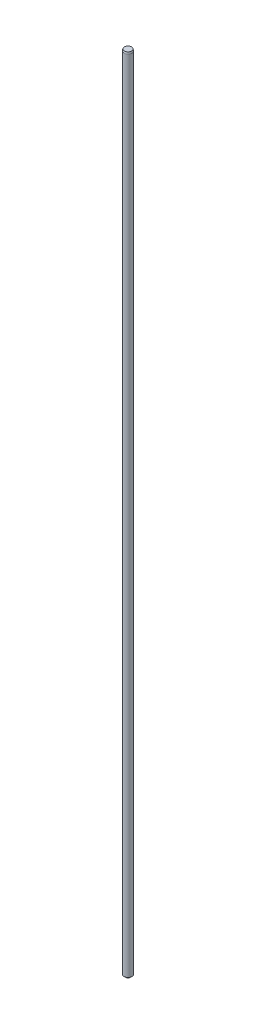
from build123d import *


with BuildPart() as part:
    # Esboço1 → Revolução1 (revolve)
    with BuildSketch(Plane(origin=(0, 0, 0), x_dir=(-1, 0, 0), z_dir=(0, 0, -1)), mode=Mode.PRIVATE) as revolu_o1_sk:
        Polygon((-6, 0.060047337), (0, 0.060047337), (0, 2000.060047337), (-8.991321605, 2000.060047337), (-10, 1996), (-10, 4.060047337), align=None)
    revolve(revolu_o1_sk.sketch.rotate(Axis((0, 0.060047337, 0), (0, 1, 0)), 270), axis=Axis((0, 0.060047337, 0), (0, 1, 0)))


solid = part.part
